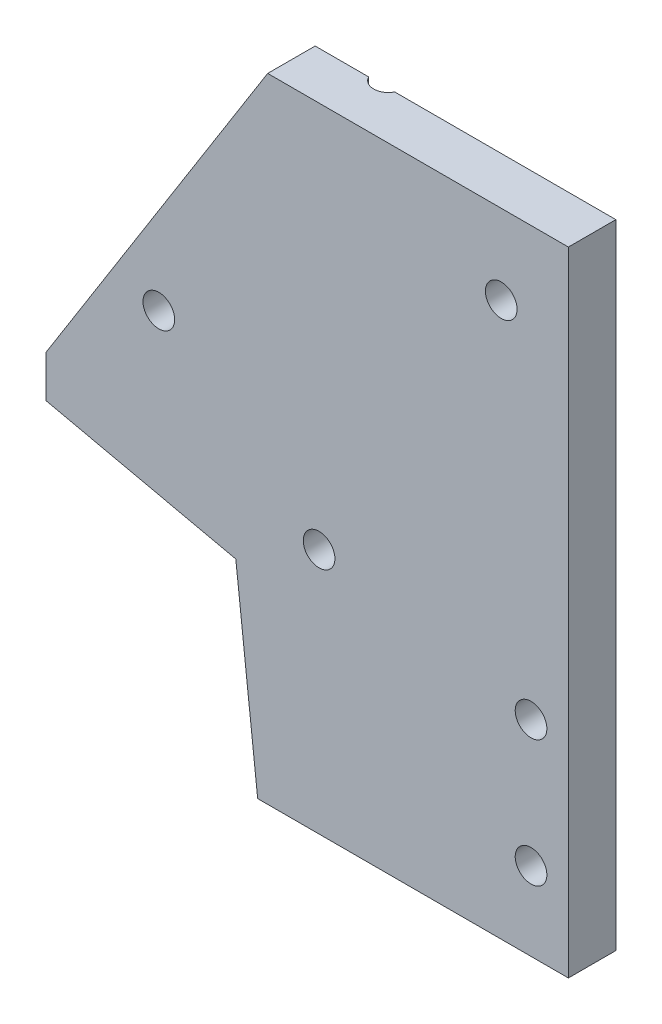
from build123d import *

# Parameters (mm, degrees)
BOSS_EXTRUDE1_DEPTH = 101.6
SKETCH1_3_W         = 36.399658141
SKETCH1_3_H         = 11.700173665
BOSS_EXTRUDE2_DEPTH = 7.62
SKETCH2_R           = 2.54
CUT_EXTRUDE1_DEPTH  = 112.58977198
SKETCH4_R           = 2.342393744
SKETCH4_R_2         = 1.801613949
SKETCH4_R_3         = 2.035024278
SKETCH4_R_4         = 2.216848317
CUT_EXTRUDE2_DEPTH  = 111.993574531


with BuildPart() as part:
    # Sketch1 → Boss-Extrude1 (new body)
    with BuildSketch(Plane(origin=(0, 0, 0), x_dir=(1, 0, 0), z_dir=(0, 1, 0))):
        Polygon((-41.91, -3.81), (-18.602457664, -3.81), (17.797200477, -3.81), (41.91, -3.81), (41.91, 3.81), (17.797200477, 3.81), (-18.602457664, 3.81), (-41.91, 3.81), align=None)
    extrude(amount=BOSS_EXTRUDE1_DEPTH)

    # Sketch1<3> → Boss-Extrude2 (add)
    with BuildSketch(Plane(origin=(0, 0, 0), x_dir=(1, 0, 0), z_dir=(0, 1, 0))):
        with Locations((-0.402628594, 9.660086833)):
            Rectangle(SKETCH1_3_W, SKETCH1_3_H)
    extrude(amount=BOSS_EXTRUDE2_DEPTH)

    # Sketch2 → Cut-Extrude1 (cut, through all)
    with BuildSketch(Plane.XY.offset(3.81)):
        with Locations((-23.8252, 59.901607654)):
            Circle(SKETCH2_R)
        with Locations((31.13358591, 88.819007782)):
            Circle(SKETCH2_R)
        with Locations((1.896113018, 39.534948803)):
            Circle(SKETCH2_R)
        with Locations((35.914623783, 12.5984)):
            Circle(SKETCH2_R)
        with Locations((35.914623783, 32.9184)):
            Circle(SKETCH2_R)
        Polygon((-41.91, 45.084065347), (-6.353580499, 101.6), (-41.91, 101.6), align=None)
        Polygon((-41.91, 38.321571432), (-11.466633524, 31.542928235), (-7.95768881, 0), (-41.91, 0), align=None)
    extrude(amount=-CUT_EXTRUDE1_DEPTH, mode=Mode.SUBTRACT)

    # Sketch4 → Cut-Extrude2 (cut, through all)
    with BuildSketch(Plane.XZ):
        with Locations((4.32420412, -4.873516041)):
            Circle(SKETCH4_R)
        with Locations((-1.801613949, -9.872883882)):
            Circle(SKETCH4_R_2)
        with Locations((-11.131176948, -7.373516021)):
            Circle(SKETCH4_R_3)
        with Locations((-14.801613949, -10.542756863)):
            Circle(SKETCH4_R_4)
    extrude(amount=-CUT_EXTRUDE2_DEPTH, mode=Mode.SUBTRACT)


solid = part.part
